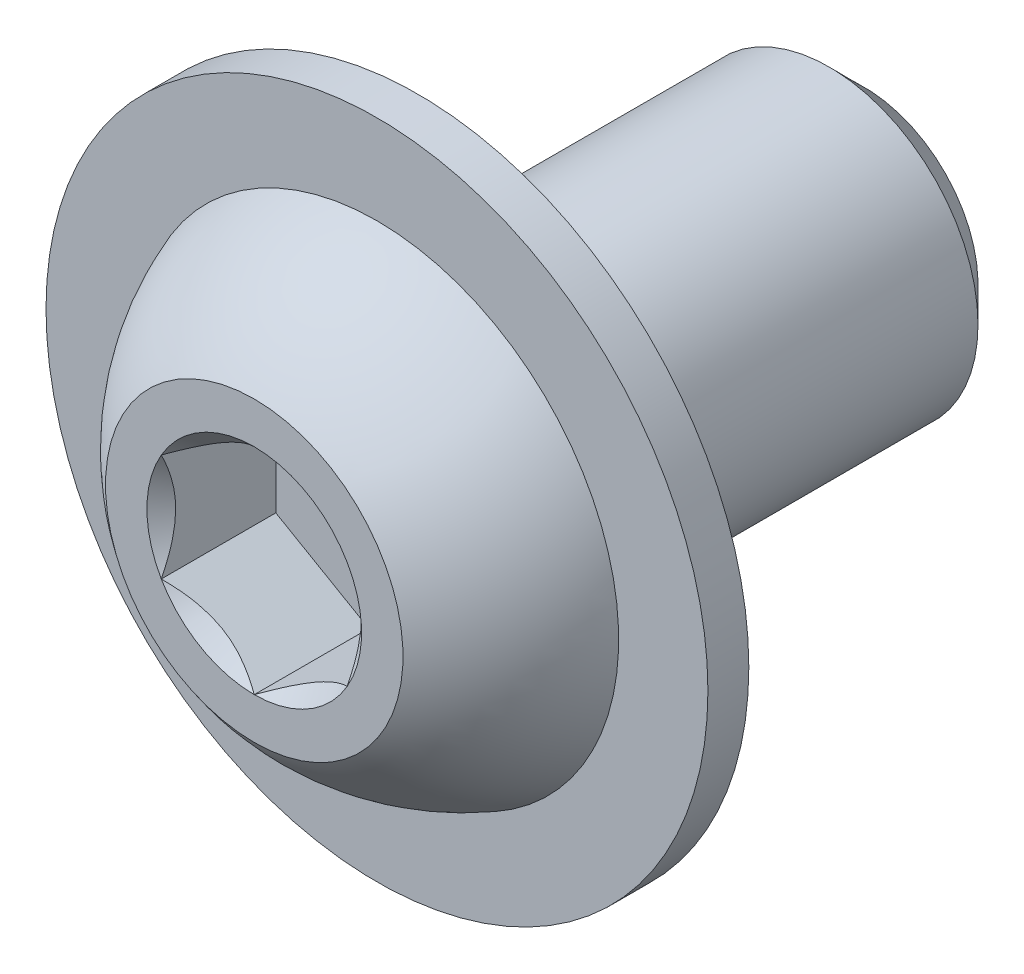
from build123d import *

# Parameters (mm, degrees)
SKETCH1_W           = 12
SKETCH1_H           = 4
CHAMFER1_SIZE       = 0.9375
SKETCH11_R          = 8.9
BOSS_EXTRUDE3_DEPTH = 1.1
CUT_EXTRUDE2_DEPTH  = 3.08


with BuildPart() as part:
    # Sketch1 → Revolve1 (revolve)
    with BuildSketch(Plane(origin=(0, 0, 0), x_dir=(0, 0, -1), z_dir=(1, 0, 0))):
        with Locations((10.4, 2)):
            Rectangle(SKETCH1_W, SKETCH1_H)
    revolve(axis=Axis((0, 0, -16.4), (0, 0, 1)))

    # Chamfer1
    chamfer1_edges = [part.edges().sort_by_distance(p)[0] for p in [
        (0, -4, -16.4),
    ]]
    chamfer(chamfer1_edges, length=CHAMFER1_SIZE)

    # Sketch7 → Revolve2 (revolve)
    with BuildSketch(Plane(origin=(0, 0, 0), x_dir=(0, 0, -1), z_dir=(1, 0, 0)), mode=Mode.PRIVATE) as revolve2_sk:
        with BuildLine():
            Line((3.3, 6.5), (4.4, 6.5))
            Line((4.4, 6.5), (4.4, 0))
            Line((4.4, 0), (0, 0))
            Line((0, 0), (0, 4))
            ThreePointArc((0, 4), (1.458196289, 5.503180898), (3.3, 6.5))
        make_face()
    revolve(revolve2_sk.sketch.rotate(Axis((0, 0, 0), (0, 0, -1)), 180), axis=Axis((0, 0, 0), (0, 0, -1)))

    # Sketch11 → Boss-Extrude3 (add)
    with BuildSketch(Plane(origin=(0, 0, -4.4), x_dir=(-1, 0, 0), z_dir=(0, 0, -1))):
        Circle(SKETCH11_R)
    extrude(amount=-BOSS_EXTRUDE3_DEPTH)

    # Sketch5 → Cut-Extrude2 (cut)
    with BuildSketch(Plane.XY):
        Polygon((2.5, -1.443375673), (2.5, 1.443375673), (0, 2.886751346), (-2.5, 1.443375673), (-2.5, -1.443375673), (0, -2.886751346), align=None)
    extrude(amount=-CUT_EXTRUDE2_DEPTH, mode=Mode.SUBTRACT)

    # Cut-Extrude3 cone 1 section (through the dimple's axis) → Cut-Extrude3 (revolve, cut)
    with BuildSketch(Plane(origin=(0, 0, 0), x_dir=(0, -1, 0), z_dir=(1, 0, 0))):
        Polygon((0, 0), (2.886751346, 0), (0, 2.886751346), align=None)
    revolve(axis=Axis((0, 0, 0), (0, 0, -1)), mode=Mode.SUBTRACT)


solid = part.part
